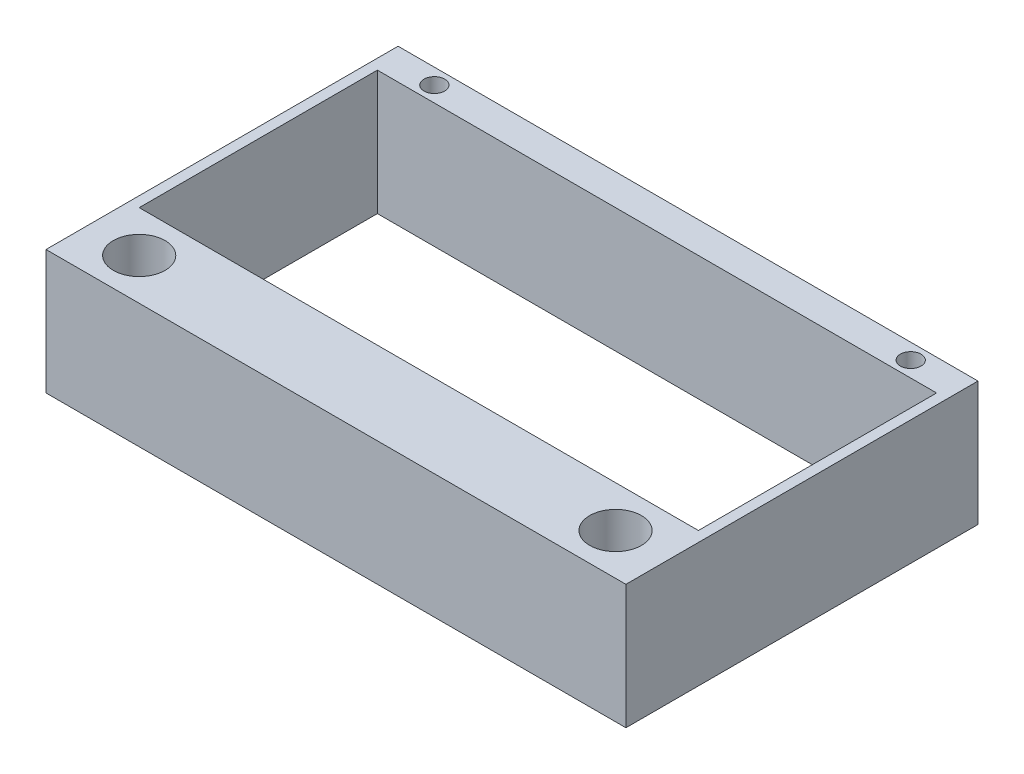
from build123d import *

# Parameters (mm, degrees)
EXTRUDE_1_DEPTH     = 12
SKETCH_4_W          = 56
SKETCH_4_H          = 2
EXTRUDE_2_DEPTH     = 12
SKETCH_3_R          = 2.5
SKETCH_3_R_2        = 1
CUT_EXTRUDE_1_DEPTH = 52.777268973


with BuildPart() as part:
    # 草图2 → 凸台-拉伸1 (new body)
    with BuildSketch(Plane(origin=(0, 0, 0), x_dir=(1, 0, 0), z_dir=(0, 1, 0))):
        Polygon((-10.725663717, 9.92920354), (45.274336283, 9.92920354), (45.274336283, -22.07079646), (-10.725663717, -22.07079646), (-10.725663717, -7.07079646), (-10.725663717, 1.92920354), align=None)
        Polygon((-9.725663717, -7.07079646), (-9.725663717, -14.07079646), (44.274336283, -14.07079646), (44.274336283, 8.92920354), (-9.725663717, 8.92920354), (-9.725663717, 0.92920354), align=None, mode=Mode.SUBTRACT)
    extrude(amount=EXTRUDE_1_DEPTH)

    # 草图4 → 凸台-拉伸2 (add)
    with BuildSketch(Plane(origin=(0, 0, 0), x_dir=(1, 0, 0), z_dir=(0, 1, 0))):
        with Locations((17.274336283, 10.92920354)):
            Rectangle(SKETCH_4_W, SKETCH_4_H)
    extrude(amount=EXTRUDE_2_DEPTH)

    # 草图3 → 切除-拉伸1 (cut, through all)
    with BuildSketch(Plane(origin=(0, 12, 0), x_dir=(1, 0, 0), z_dir=(0, 1, 0))):
        with Locations(Location((-5.725663717, -18.07079646, 0), (0, 0, 270))):
            Circle(SKETCH_3_R)
        with Locations(Location((40.274336283, -18.07079646, 0), (0, 0, 270))):
            Circle(SKETCH_3_R)
        with Locations(Location((-5.725663717, 10.42920354, 0), (0, 0, 270))):
            Circle(SKETCH_3_R_2)
        with Locations(Location((40.274336283, 10.42920354, 0), (0, 0, 270))):
            Circle(SKETCH_3_R_2)
    extrude(amount=-CUT_EXTRUDE_1_DEPTH, mode=Mode.SUBTRACT)


solid = part.part
